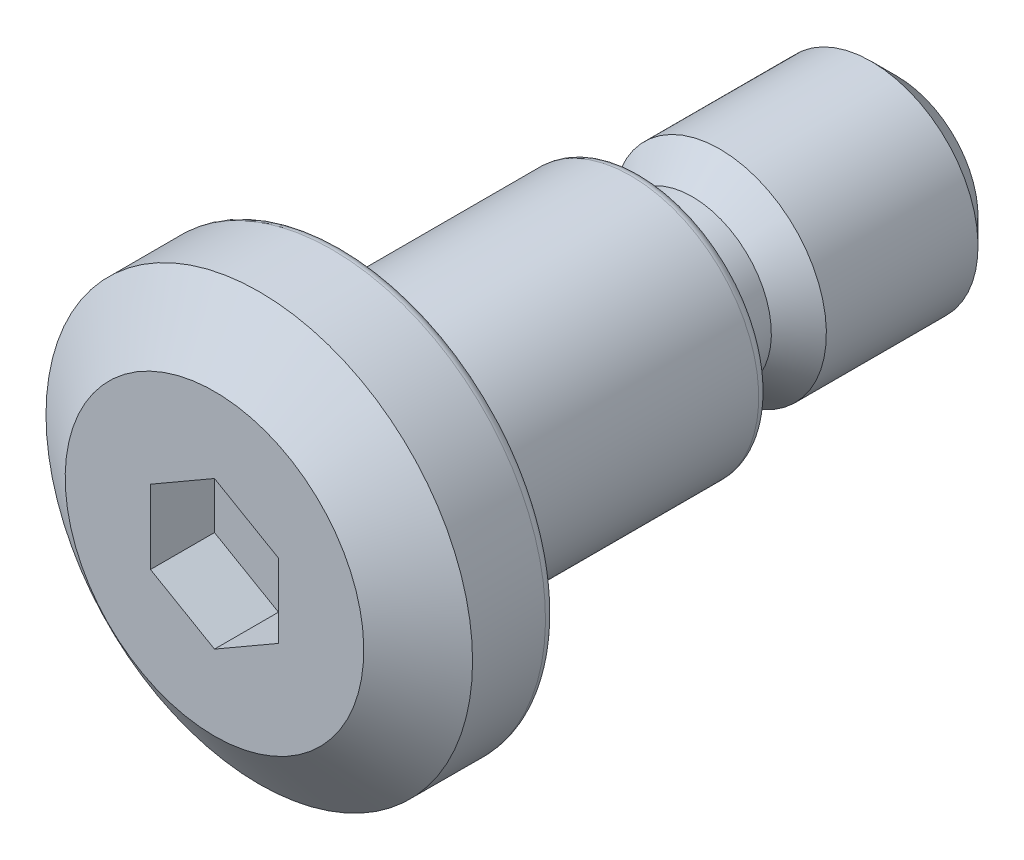
from build123d import *

# Parameters (mm, degrees)
CUT_EXTRUDE2_DEPTH = 1.5
CHAMFER1_SIZE      = 0.6
CHAMFER2_SIZE      = 1.5
CHAMFER2_SIZE2     = 1.050311307
FILLET1_R          = 0.24
FILLET2_R          = 0.6


with BuildPart() as part:
    # Sketch10 → Revolve1 (revolve)
    with BuildSketch(Plane(origin=(0, 0, 0), x_dir=(0, 0, -1), z_dir=(1, 0, 0))):
        Polygon((10, 3), (10, 2.5), (16, 2.5), (16, 0), (0, 0), (0, 5), (3, 5), (3, 3), align=None)
    revolve(axis=Axis((0, 0, -16), (0, 0, 1)))

    # Sketch5 → Cut-Revolve1 (revolve, cut)
    with BuildSketch(Plane(origin=(0, 0, 0), x_dir=(0, 0, -1), z_dir=(1, 0, 0))):
        with BuildLine():
            Line((10, 3), (12.345, 3))
            Line((12.345, 3), (11.2, 1.855))
            Line((11.2, 1.855), (10.645, 1.855))
            ThreePointArc((10.645, 1.855), (10.188916126, 2.043916126), (10, 2.5))
            Line((10, 2.5), (10, 3))
        make_face()
    revolve(axis=Axis((0, 0, -16), (0, 0, 1)), mode=Mode.SUBTRACT)

    # Sketch8 → Cut-Extrude2 (cut)
    with BuildSketch(Plane.XY):
        Polygon((0, 1.732050808), (-1.5, 0.866025404), (-1.5, -0.866025404), (0, -1.732050808), (1.5, -0.866025404), (1.5, 0.866025404), align=None)
    extrude(amount=-CUT_EXTRUDE2_DEPTH, mode=Mode.SUBTRACT)

    # Chamfer1
    chamfer1_edges = [part.edges().sort_by_distance(p)[0] for p in [
        (0, -2.5, -16),
    ]]
    chamfer(chamfer1_edges, length=CHAMFER1_SIZE)

    # Chamfer2
    chamfer2_edges = [part.edges().sort_by_distance(p)[0] for p in [
        (0, -5, 0),
    ]]
    chamfer2_side = [part.faces().sort_by_distance(p)[0] for p in [
        (0, -4.858578644, 0),
    ]]
    chamfer(chamfer2_edges, length=CHAMFER2_SIZE, length2=CHAMFER2_SIZE2, reference=chamfer2_side[0])

    # Fillet1
    fillet1_edges = [part.edges().sort_by_distance(p)[0] for p in [
        (0, -3, -10),
        (0, -5, -3),
    ]]
    fillet(fillet1_edges, radius=FILLET1_R)

    # Fillet2
    fillet2_edges = [part.edges().sort_by_distance(p)[0] for p in [
        (0, -3, -3),
    ]]
    fillet(fillet2_edges, radius=FILLET2_R)


solid = part.part
